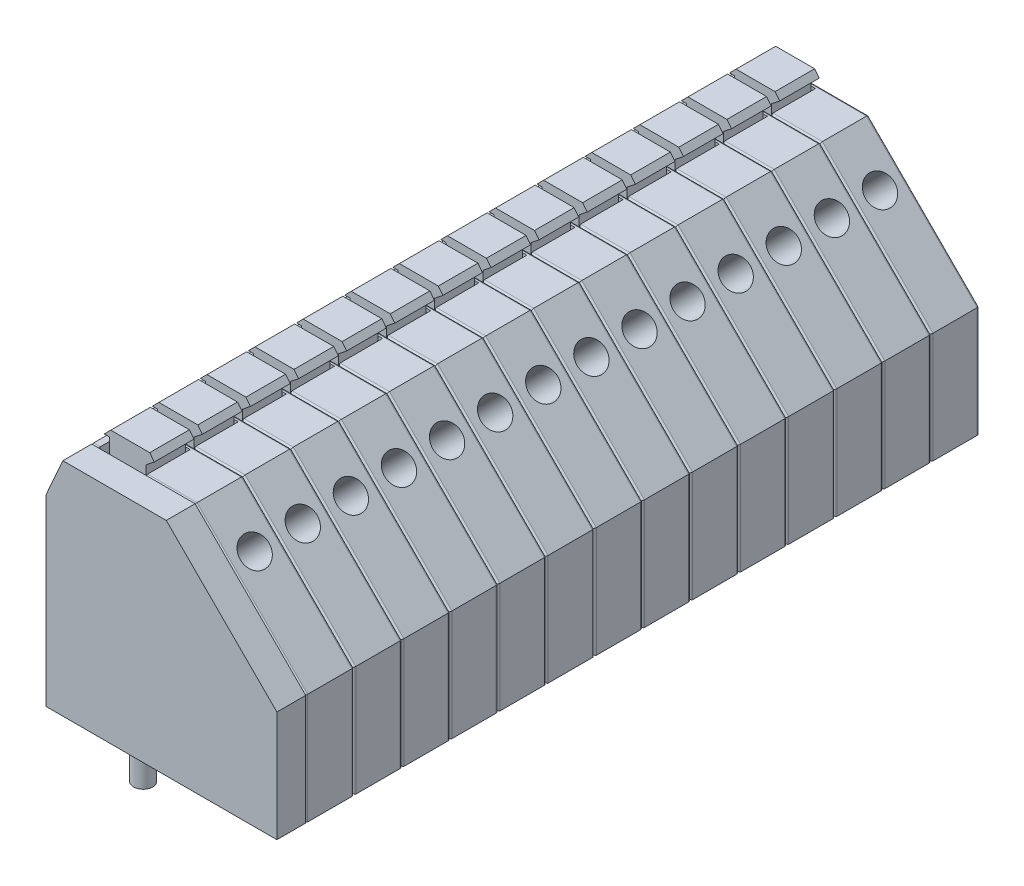
from build123d import *

# Parameters (mm, degrees)
BOSS_EXTRUDE1_DEPTH = 2.5
SKETCH2_R           = 0.75
CUT_EXTRUDE1_DEPTH  = 5
SKETCH3_W           = 2.463564272
SKETCH3_H           = 3.137802915
CUT_EXTRUDE2_DEPTH  = 2
SKETCH9_R           = 0.755713579
CUT_EXTRUDE3_DEPTH  = 0.2
BOSS_EXTRUDE2_DEPTH = 2.060257372
FILLET1_R           = 0.1
LPATTERN1_COUNT     = 14
LPATTERN1_PITCH     = 2.5
SKETCH11_R          = 0.5
BOSS_EXTRUDE3_DEPTH = 3.6
LPATTERN2_COUNT     = 7
LPATTERN2_PITCH     = 5
BOSS_EXTRUDE4_DEPTH = 1.5


with BuildPart() as part:
    # Sketch1 → Boss-Extrude1 (new body)
    with BuildSketch(Plane.XY):
        Polygon((0, 0), (12, 0), (12, 5.75), (6.25, 11.5), (0.875138122, 11.5), (0, 9.527071823), align=None)
    extrude(amount=BOSS_EXTRUDE1_DEPTH)

    # Sketch2 → Cut-Extrude1 (cut)
    with BuildSketch(Plane(origin=(8.875, 8.875, 0), x_dir=(0, 0, -1), z_dir=(0.7071067811865464, 0.7071067811865488, 0))):
        with Locations(Location((-1.25, 1.10118655, 0), (0, 0, 90))):
            Circle(SKETCH2_R)
    extrude(amount=-CUT_EXTRUDE1_DEPTH, mode=Mode.SUBTRACT)

    # Sketch3 → Cut-Extrude2 (cut)
    with BuildSketch(Plane(origin=(0, 11.5, 0), x_dir=(1, 0, 0), z_dir=(0, 1, 0))):
        with Locations((2.451603039, -1.758644086)):
            Rectangle(SKETCH3_W, SKETCH3_H)
    extrude(amount=-CUT_EXTRUDE2_DEPTH, mode=Mode.SUBTRACT)

    # Sketch9 → Cut-Extrude3 (cut)
    with BuildSketch(Plane(origin=(0, 0, 0), x_dir=(-1, 0, 0), z_dir=(0, 0, -1))):
        with Locations((-7.824779814, 2.638779832)):
            Circle(SKETCH9_R)
        with Locations((-2.362615501, 8.130785084)):
            Circle(SKETCH9_R)
    extrude(amount=-CUT_EXTRUDE3_DEPTH, mode=Mode.SUBTRACT)

    # Sketch10 → Boss-Extrude2 (add)
    with BuildSketch(Plane.XY.offset(0.189742628)):
        Polygon((1.540096875, 9.5), (1.540096875, 12.028767147), (1.274560691, 12.028767147), (1.616062557, 12.370269013), (3.64101661, 12.370269013), (3.880727385, 12.069192449), (3.452584044, 11.728313801), (3.452584044, 9.5), align=None)
    extrude(amount=BOSS_EXTRUDE2_DEPTH)

    # Fillet1
    fillet1_edges = [part.edges().sort_by_distance(p)[0] for p in [
        (4.966692588, 11.5, 2.5),
        (0.437569061, 10.513535912, 2.5),
        (0, 4.763535912, 2.5),
        (6, 0, 2.5),
        (1.047479512, 11.5, 2.5),
        (2.451603039, 9.5, 2.5),
        (3.683385175, 10.5, 2.5),
        (1.219820903, 10.5, 2.5),
        (12, 2.875, 2.5),
        (8.580493393, 2.638779832, 0),
        (3.11832908, 8.130785084, 0),
        (6, 0, 0),
        (0, 4.763535912, 0),
        (0.437569061, 10.513535912, 0),
        (9.125, 8.625, 2.5),
        (3.562569061, 11.5, 0),
        (9.125, 8.625, 0),
        (12, 2.875, 0),
    ]]
    fillet(fillet1_edges, radius=FILLET1_R)


with BuildPart() as lpattern1_1:
    # LPattern1: pattern copy
    add(part.part.moved(Location(Vector(0, 0, 1) * (1 * LPATTERN1_PITCH))))


with BuildPart() as lpattern1_2:
    # LPattern1: pattern copy
    add(part.part.moved(Location(Vector(0, 0, 1) * (2 * LPATTERN1_PITCH))))


with BuildPart() as lpattern1_3:
    # LPattern1: pattern copy
    add(part.part.moved(Location(Vector(0, 0, 1) * (3 * LPATTERN1_PITCH))))


with BuildPart() as lpattern1_4:
    # LPattern1: pattern copy
    add(part.part.moved(Location(Vector(0, 0, 1) * (4 * LPATTERN1_PITCH))))


with BuildPart() as lpattern1_5:
    # LPattern1: pattern copy
    add(part.part.moved(Location(Vector(0, 0, 1) * (5 * LPATTERN1_PITCH))))


with BuildPart() as lpattern1_6:
    # LPattern1: pattern copy
    add(part.part.moved(Location(Vector(0, 0, 1) * (6 * LPATTERN1_PITCH))))


with BuildPart() as lpattern1_7:
    # LPattern1: pattern copy
    add(part.part.moved(Location(Vector(0, 0, 1) * (7 * LPATTERN1_PITCH))))


with BuildPart() as lpattern1_8:
    # LPattern1: pattern copy
    add(part.part.moved(Location(Vector(0, 0, 1) * (8 * LPATTERN1_PITCH))))


with BuildPart() as lpattern1_9:
    # LPattern1: pattern copy
    add(part.part.moved(Location(Vector(0, 0, 1) * (9 * LPATTERN1_PITCH))))


with BuildPart() as lpattern1_10:
    # LPattern1: pattern copy
    add(part.part.moved(Location(Vector(0, 0, 1) * (10 * LPATTERN1_PITCH))))


with BuildPart() as lpattern1_11:
    # LPattern1: pattern copy
    add(part.part.moved(Location(Vector(0, 0, 1) * (11 * LPATTERN1_PITCH))))


with BuildPart() as lpattern1_12:
    # LPattern1: pattern copy
    add(part.part.moved(Location(Vector(0, 0, 1) * (12 * LPATTERN1_PITCH))))


with BuildPart() as lpattern1_13:
    # LPattern1: pattern copy
    add(part.part.moved(Location(Vector(0, 0, 1) * (13 * LPATTERN1_PITCH))))


with BuildPart() as part_1:
    add(part.part)

    add(lpattern1_1.part)  # Boss-Extrude3 merges LPattern1_1
    # Sketch11 → Boss-Extrude3 (add)
    with BuildSketch(Plane.XZ):
        with Locations(Location((7.3, 1.25, 0), (0, 0, 90))):
            Circle(SKETCH11_R)
        with Locations(Location((2.3, 3.75, 0), (0, 0, 90))):
            Circle(SKETCH11_R)
    boss_extrude3 = extrude(amount=BOSS_EXTRUDE3_DEPTH)


with BuildPart() as lpattern1_2_1:
    add(lpattern1_2.part)

    add(lpattern1_3.part)  # LPattern2 merges LPattern1_3

    add(lpattern1_4.part)  # LPattern2 merges LPattern1_4

    add(lpattern1_5.part)  # LPattern2 merges LPattern1_5

    add(lpattern1_6.part)  # LPattern2 merges LPattern1_6

    add(lpattern1_7.part)  # LPattern2 merges LPattern1_7

    add(lpattern1_8.part)  # LPattern2 merges LPattern1_8

    add(lpattern1_9.part)  # LPattern2 merges LPattern1_9

    add(lpattern1_10.part)  # LPattern2 merges LPattern1_10

    add(lpattern1_11.part)  # LPattern2 merges LPattern1_11

    add(lpattern1_12.part)  # LPattern2 merges LPattern1_12

    add(lpattern1_13.part)  # LPattern2 merges LPattern1_13
    # LPattern2: Boss-Extrude3 ×7
    with Locations(*[(0, 0, i * LPATTERN2_PITCH) for i in range(1, LPATTERN2_COUNT)]):
        add(boss_extrude3)

    # Sketch12 → Boss-Extrude4 (add)
    with BuildSketch(Plane.XY.offset(35)):
        Polygon((0, 0), (0, 9.527071823), (0.875138122, 11.5), (6.25, 11.5), (12, 5.75), (12, 0), align=None)
    extrude(amount=BOSS_EXTRUDE4_DEPTH)


solid = Compound([part_1.part, lpattern1_2_1.part])
